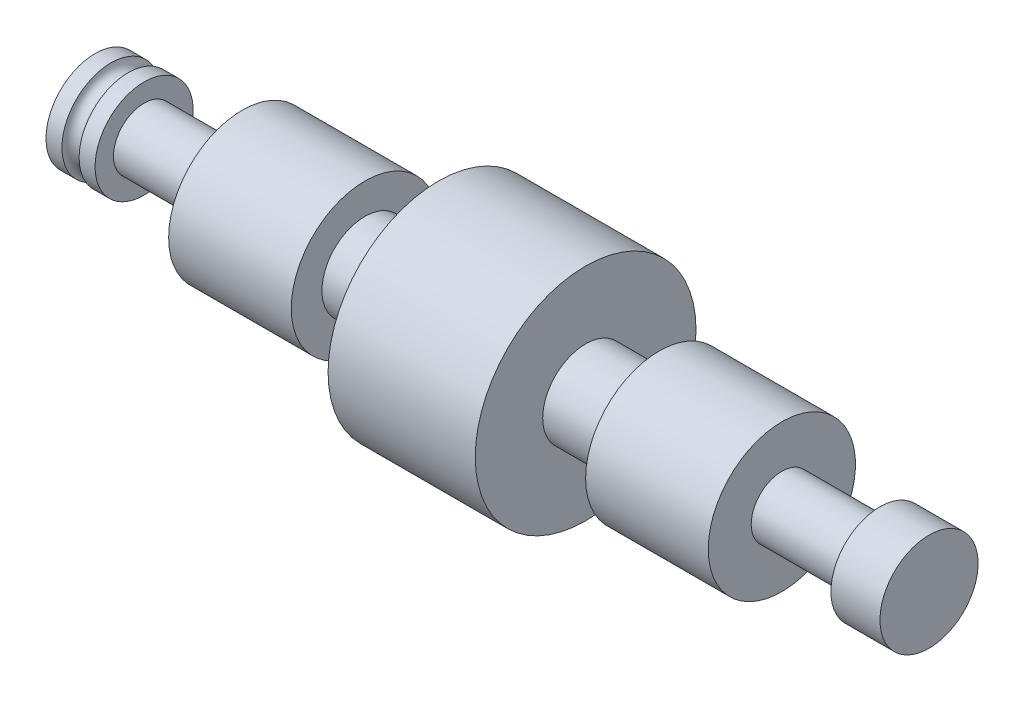
from build123d import *

# Parameters (mm, degrees)
SKETCH2_R = 3.5


with BuildPart() as part:
    # Sketch1 → Revolve1 (revolve)
    with BuildSketch(Plane.XY, mode=Mode.PRIVATE) as revolve1_sk:
        Polygon((-170, 0), (-170, 20), (-150, 20), (-150, 12.5), (-110, 12.5), (-110, 30), (-60, 30), (-60, 17.5), (-30, 17.5), (-30, 45), (0, 45), (0, 0), align=None)
    revolve1 = revolve(revolve1_sk.sketch.rotate(Axis((-99.144385027, 0, 0), (1, 0, 0)), 90), axis=Axis((-99.144385027, 0, 0), (1, 0, 0)))

    # Sketch2 → Cut-Revolve1 (revolve, cut)
    with BuildSketch(Plane.XY, mode=Mode.PRIVATE) as cut_revolve1_sk:
        with Locations((-160, 20.12160323)):
            Circle(SKETCH2_R)
    revolve(cut_revolve1_sk.sketch.rotate(Axis((-170, 0, 0), (1, 0, 0)), 90), axis=Axis((-170, 0, 0), (1, 0, 0)), mode=Mode.SUBTRACT)

    # Mirror1: Revolve1 across plane
    add(revolve1.mirror(Plane(origin=(0, 0, 0), x_dir=(0, 0, 1), z_dir=(1, 0, 0))))


solid = part.part
